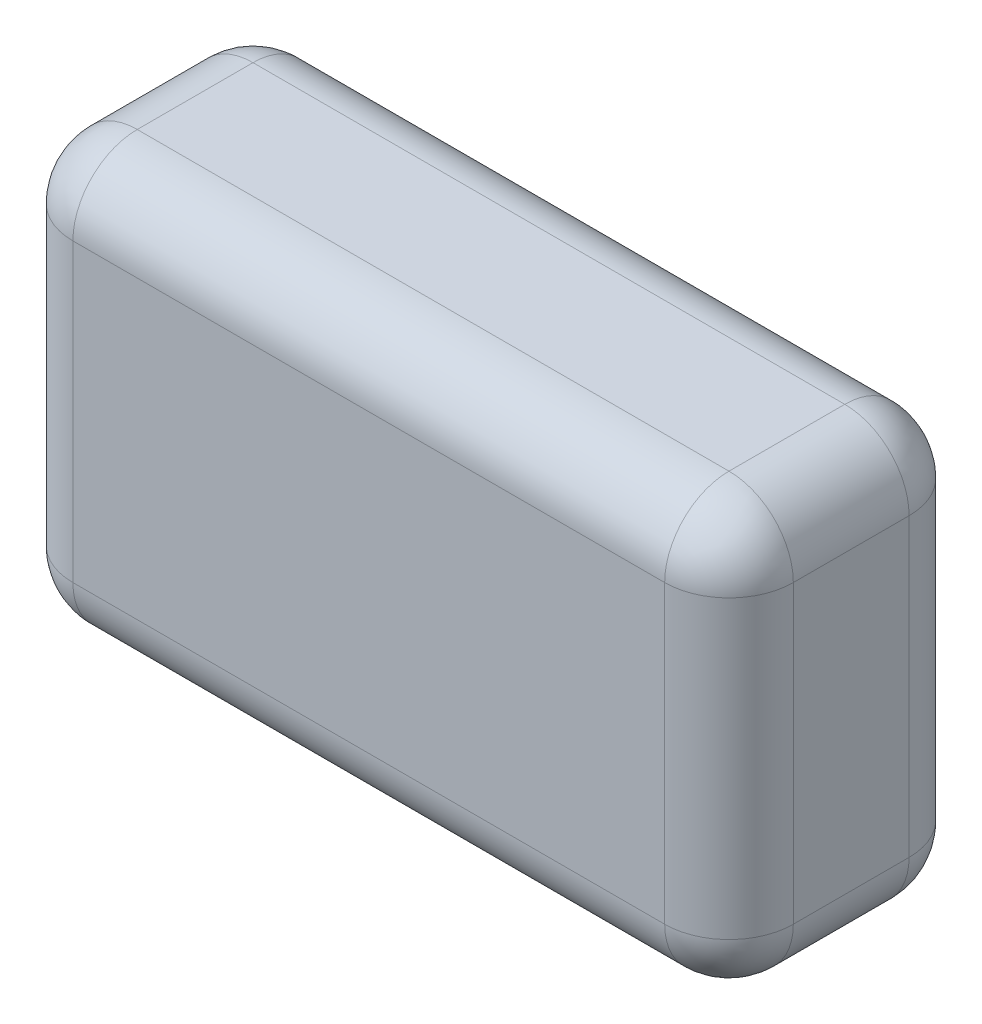
from build123d import *

# Parameters (mm, degrees)
BOSS_EXTRUDE1_DEPTH = 38
FILLET1_R           = 10


with BuildPart() as part:
    # Sketch1 → Boss-Extrude1 (new body)
    with BuildSketch(Plane.XY):
        with BuildLine():
            Line((-46, 33), (46, 33))
            ThreePointArc((46, 33), (53.071067812, 30.071067812), (56, 23))
            Line((56, 23), (56, -23))
            ThreePointArc((56, -23), (53.071067812, -30.071067812), (46, -33))
            Line((46, -33), (-46, -33))
            ThreePointArc((-46, -33), (-53.071067812, -30.071067812), (-56, -23))
            Line((-56, -23), (-56, 23))
            ThreePointArc((-56, 23), (-53.071067812, 30.071067812), (-46, 33))
        make_face()
    extrude(amount=BOSS_EXTRUDE1_DEPTH)

    # Fillet1
    fillet1_edges = [part.edges().sort_by_distance(p)[0] for p in [
        (-56, 0, 0),
        (-53.071067812, 30.071067812, 0),
        (0, 33, 0),
        (53.071067812, 30.071067812, 0),
        (-53.071067812, 30.071067812, 38),
        (-56, 0, 38),
        (-53.071067812, -30.071067812, 38),
        (0, -33, 38),
        (53.071067812, -30.071067812, 38),
        (56, 0, 38),
        (53.071067812, 30.071067812, 38),
        (56, 0, 0),
        (0, 33, 38),
        (53.071067812, -30.071067812, 0),
        (0, -33, 0),
        (-53.071067812, -30.071067812, 0),
    ]]
    fillet(fillet1_edges, radius=FILLET1_R)


solid = part.part
